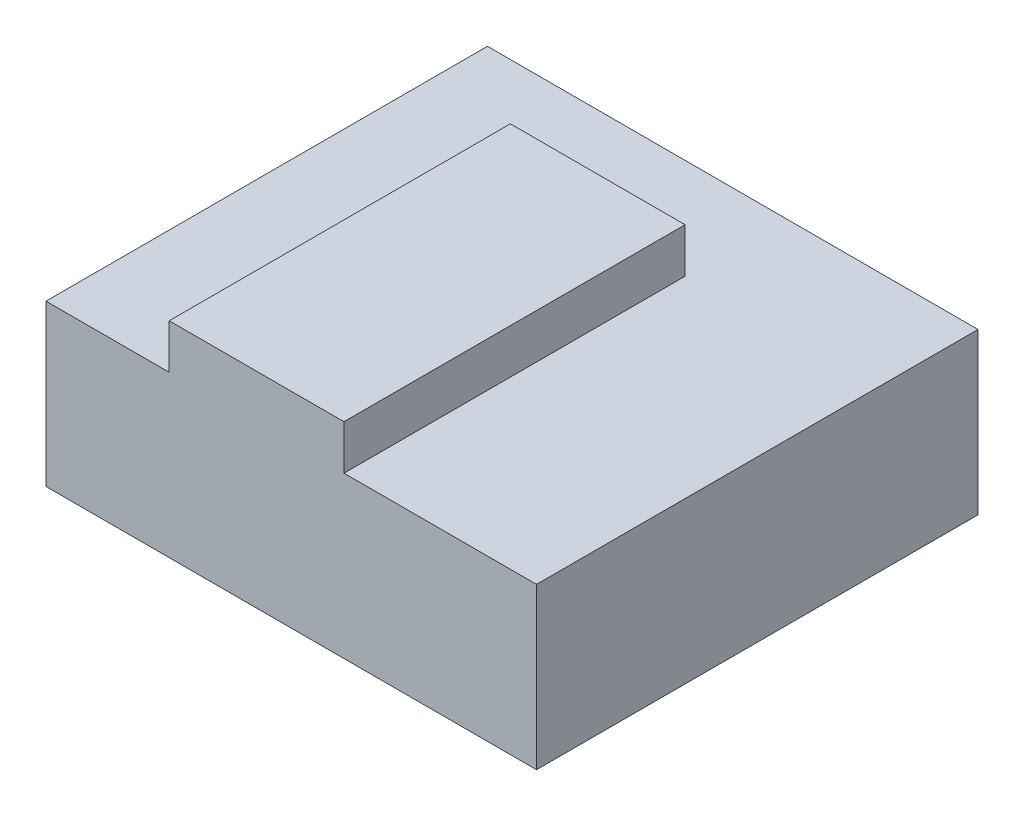
from build123d import *

# Parameters (mm, degrees)
SKETCH1_W           = 110
SKETCH1_H           = 99
BOSS_EXTRUDE1_DEPTH = 46
CUT_EXTRUDE1_DEPTH  = 10


with BuildPart() as part:
    # Sketch1 → Boss-Extrude1 (new body)
    with BuildSketch(Plane(origin=(0, 0, 0), x_dir=(1, 0, 0), z_dir=(0, 1, 0))):
        with Locations((55, 49.5)):
            Rectangle(SKETCH1_W, SKETCH1_H)
    extrude(amount=BOSS_EXTRUDE1_DEPTH)

    # Sketch2 → Cut-Extrude1 (cut)
    with BuildSketch(Plane(origin=(0, 46, 0), x_dir=(1, 0, 0), z_dir=(0, 1, 0))):
        Polygon((66.818964176, 76.503466617), (66.818964176, 0), (110, 0), (110, 99), (0, 99), (0, 0), (27.626705407, 0), (27.626705407, 76.503466617), align=None)
    extrude(amount=-CUT_EXTRUDE1_DEPTH, mode=Mode.SUBTRACT)


solid = part.part
